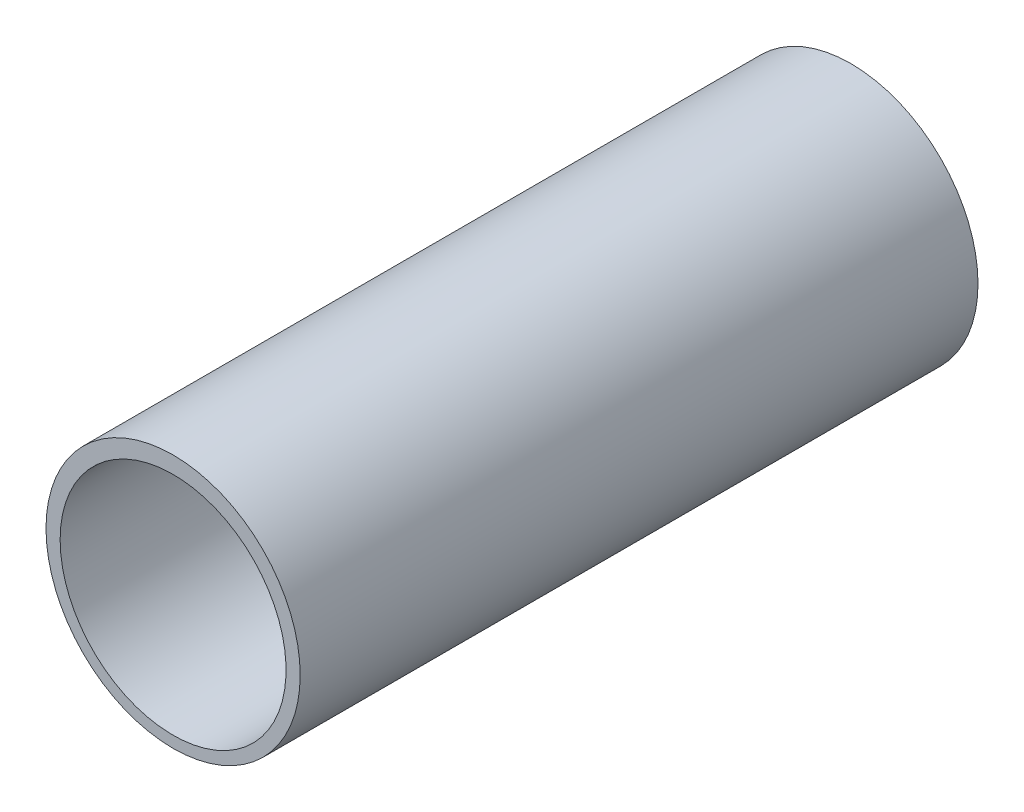
from build123d import *

# Parameters (mm, degrees)
SKETCH5_R               = 57.15
BOSS_EXTRUDE5_DEPTH     = 304.8
CUT_EXTRUDE5_DEPTH      = 316.333609056
CUT_EXTRUDE5_DEPTH_BACK = 316.333609056
SKETCH7_R               = 50.8


with BuildPart() as part:
    # Sketch5 → Boss-Extrude5 (new body)
    with BuildSketch(Plane.XY):
        with Locations(Location((0, 0, 0), (0, 0, 180))):
            Circle(SKETCH5_R)
    extrude(amount=BOSS_EXTRUDE5_DEPTH)

    # Sketch7 → Cut-Extrude5 (cut, two sides: drawn at the far end of the back side and taken through both)
    with BuildSketch(Plane(origin=(0, 0, 0), x_dir=(-1, 0, 0), z_dir=(0, 0, -1)).offset(-CUT_EXTRUDE5_DEPTH_BACK)):
        with Locations((0, -1.224817028)):
            Circle(SKETCH7_R)
    extrude(amount=CUT_EXTRUDE5_DEPTH + CUT_EXTRUDE5_DEPTH_BACK, mode=Mode.SUBTRACT)


solid = part.part
